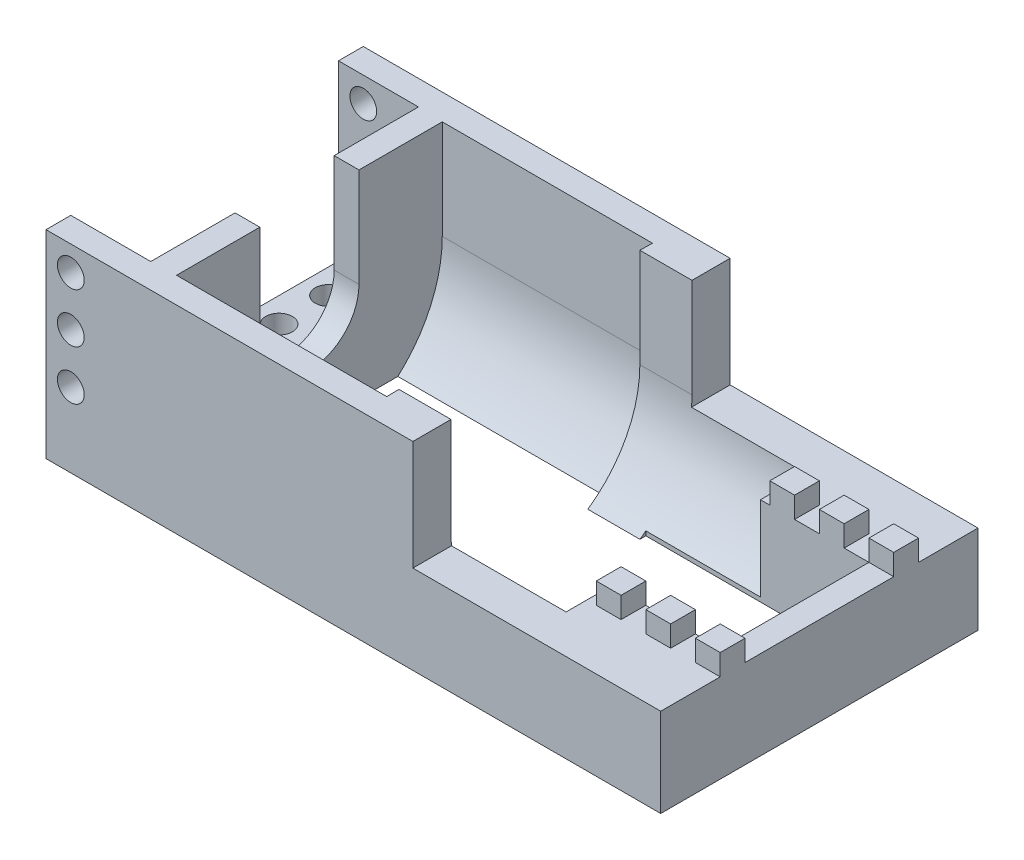
from build123d import *

# Parameters (mm, degrees)
SKETCH1_W                = 157.48
SKETCH1_H                = 50.8
BOSS_EXTRUDE1_DEPTH      = 40.64
SKETCH37_W               = 81.28
SKETCH37_H               = 25.4
CUT_EXTRUDE32_DEPTH      = 171.388379885
BOSS_EXTRUDE5_DEPTH      = 25.4
CUT_EXTRUDE54_DEPTH      = 105.109019782
CUT_EXTRUDE54_DEPTH_BACK = 105.109019782
SKETCH45_W               = 63.5
SKETCH45_H               = 28.09875
SKETCH97_W               = 20.4891
SKETCH97_H               = 81.28
CUT_EXTRUDE72_DEPTH      = 44.45
SKETCH98_R               = 3.429
CUT_EXTRUDE73_DEPTH      = 102.162495521
SKETCH99_W               = 57.15
SKETCH99_H               = 38.1
CUT_EXTRUDE74_DEPTH      = 105.109019782
SKETCH101_W              = 6.35
SKETCH101_H              = 6.35
BOSS_EXTRUDE7_DEPTH      = 5.3975
BOSS_EXTRUDE8_REACH      = 106.109
SKETCH102_W              = 20.4891
SKETCH102_H              = 6.35
SKETCH103_R              = 3.429
CUT_EXTRUDE75_DEPTH      = 126.672259469


with BuildPart() as part:
    # Sketch1 → Boss-Extrude1 (new, symmetric)
    with BuildSketch(Plane.XY):
        with Locations((2.54, -25.4)):
            Rectangle(SKETCH1_W, SKETCH1_H)
    extrude(amount=BOSS_EXTRUDE1_DEPTH, both=True)

    # Sketch2 → Cut-Revolve1 (revolve, cut)
    with BuildSketch(Plane.XY, mode=Mode.PRIVATE) as cut_revolve1_sk:
        Polygon((-49.3609, 8.636), (-49.3609, -12.7), (-76.2, -12.7), (-76.2, -25.4), (19.629439755, -25.4), (72.533481331, -25.4), (72.533481331, -15.494), (47.133481331, -15.494), (47.133481331, 5.461390138), (4.437328256, 5.461390138), (4.4871, 8.636), align=None)
    revolve(cut_revolve1_sk.sketch.rotate(Axis((-607.361866059, -25.4, 0), (1, 0, 0)), 90), axis=Axis((-607.361866059, -25.4, 0), (1, 0, 0)), mode=Mode.SUBTRACT)

    # Sketch37 → Cut-Extrude32 (cut, through all)
    with BuildSketch(Plane(origin=(81.28, 0, 0), x_dir=(0, 0, -1), z_dir=(1, 0, 0))):
        with Locations((0, -12.7)):
            Rectangle(SKETCH37_W, SKETCH37_H)
    extrude(amount=-CUT_EXTRUDE32_DEPTH, mode=Mode.SUBTRACT)

    # Sketch39 → Boss-Extrude5 (add)
    with BuildSketch(Plane(origin=(0, -25.4, 0), x_dir=(1, 0, 0), z_dir=(0, 1, 0))):
        Polygon((-49.3609, -12.7), (-76.2, -12.7), (-76.2, -40.64), (81.28, -40.64), (81.28, 40.64), (-76.2, 40.64), (-76.2, 12.7), (-49.3609, 12.7), (-49.3609, 34.036), (4.4871, 34.036), (4.437328256, 30.861390138), (47.133481331, 30.861390138), (47.133481331, 9.906), (72.533481331, 9.906), (72.533481331, -9.906), (47.133481331, -9.906), (47.133481331, -30.861390138), (4.437328256, -30.861390138), (4.4871, -34.036), (-49.3609, -34.036), align=None)
    extrude(amount=BOSS_EXTRUDE5_DEPTH)

    # Sketch45 → Cut-Extrude54 (cut, two sides: drawn at the far end of the back side and taken through both)
    with BuildSketch(Plane.XY.offset(-CUT_EXTRUDE54_DEPTH_BACK)):
        with Locations((49.53, -14.049375)):
            Rectangle(SKETCH45_W, SKETCH45_H)
    extrude(amount=CUT_EXTRUDE54_DEPTH + CUT_EXTRUDE54_DEPTH_BACK, mode=Mode.SUBTRACT)

    # Sketch97 → Cut-Extrude72 (cut)
    with BuildSketch(Plane(origin=(0, 0, 0), x_dir=(1, 0, 0), z_dir=(0, 1, 0))):
        with Locations((-65.95545, 0)):
            Rectangle(SKETCH97_W, SKETCH97_H)
    extrude(amount=-CUT_EXTRUDE72_DEPTH, mode=Mode.SUBTRACT)

    # Sketch98 → Cut-Extrude73 (cut, through all)
    with BuildSketch(Plane(origin=(0, -44.45, 0), x_dir=(1, 0, 0), z_dir=(0, 1, 0))):
        with Locations(Location((-69.85, 25.4, 0), (0, 0, 270))):
            Circle(SKETCH98_R)
        with Locations(Location((-69.85, 12.7, 0), (0, 0, 270))):
            Circle(SKETCH98_R)
        with Locations(Location((-69.85, 0, 0), (0, 0, 270))):
            Circle(SKETCH98_R)
        with Locations(Location((-69.85, -12.7, 0), (0, 0, 270))):
            Circle(SKETCH98_R)
        with Locations(Location((-69.85, -25.4, 0), (0, 0, 270))):
            Circle(SKETCH98_R)
    extrude(amount=-CUT_EXTRUDE73_DEPTH, mode=Mode.SUBTRACT)

    # Sketch99 → Cut-Extrude74 (cut, through all)
    with BuildSketch(Plane(origin=(0, 0, 0), x_dir=(1, 0, 0), z_dir=(0, 1, 0))):
        with Locations((46.355, 0)):
            Rectangle(SKETCH99_W, SKETCH99_H)
    extrude(amount=-CUT_EXTRUDE74_DEPTH, mode=Mode.SUBTRACT)

    # Sketch101 → Boss-Extrude7 (add)
    with BuildSketch(Plane(origin=(0, -28.09875, 0), x_dir=(1, 0, 0), z_dir=(0, 1, 0))):
        with Locations((52.705, 22.225)):
            Rectangle(SKETCH101_W, SKETCH101_H)
        with Locations((65.405, 22.225)):
            Rectangle(SKETCH101_W, SKETCH101_H)
        with Locations((78.105, 22.225)):
            Rectangle(SKETCH101_W, SKETCH101_H)
        with Locations((78.105, -22.225)):
            Rectangle(SKETCH101_W, SKETCH101_H)
        with Locations((65.405, -22.225)):
            Rectangle(SKETCH101_W, SKETCH101_H)
        with Locations((52.705, -22.225)):
            Rectangle(SKETCH101_W, SKETCH101_H)
    extrude(amount=BOSS_EXTRUDE7_DEPTH)

    # Sketch102 → Boss-Extrude8 (add, up to next)
    with BuildSketch(Plane(origin=(0, 0, 0), x_dir=(1, 0, 0), z_dir=(0, 1, 0)), mode=Mode.PRIVATE) as boss_extrude8_sk1:
        with Locations((-65.95545, 37.465)):
            Rectangle(SKETCH102_W, SKETCH102_H)
    boss_extrude8_tool1 = extrude(boss_extrude8_sk1.sketch, amount=-BOSS_EXTRUDE8_REACH, mode=Mode.PRIVATE) - part.part
    # Sketch102 → Boss-Extrude8 (add, up to next)
    with BuildSketch(Plane(origin=(0, 0, 0), x_dir=(1, 0, 0), z_dir=(0, 1, 0)), mode=Mode.PRIVATE) as boss_extrude8_sk2:
        with Locations((-65.95545, -37.465)):
            Rectangle(SKETCH102_W, SKETCH102_H)
    boss_extrude8_tool2 = extrude(boss_extrude8_sk2.sketch, amount=-BOSS_EXTRUDE8_REACH, mode=Mode.PRIVATE) - part.part
    add(boss_extrude8_tool1.solids().sort_by_distance((-65.95545, 0, -37.465))[0])
    add(boss_extrude8_tool2.solids().sort_by_distance((-65.95545, 0, 37.465))[0])

    # Sketch103 → Cut-Extrude75 (cut, through all)
    with BuildSketch(Plane.XY.offset(40.64)):
        with Locations((-69.85, -6.35)):
            Circle(SKETCH103_R)
        with Locations((-69.85, -19.05)):
            Circle(SKETCH103_R)
        with Locations((-69.85, -31.75)):
            Circle(SKETCH103_R)
    extrude(amount=-CUT_EXTRUDE75_DEPTH, mode=Mode.SUBTRACT)


solid = part.part
